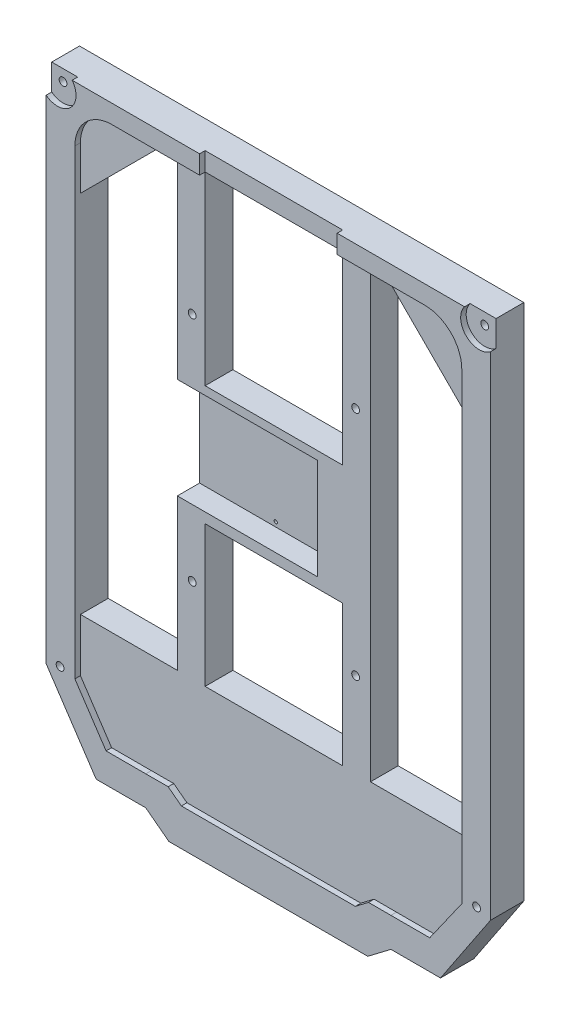
from build123d import *

# Parameters (mm, degrees)
BOSS_EXTRU_1_DEPTH                                = 30
ENL_V_MAT_EXTRU_1_DEPTH                           = 15
BOSS_EXTRU_2_DEPTH                                = 10
BOSS_EXTRU_3_DEPTH                                = 10
BOSS_EXTRU_4_DEPTH                                = 10
BOSS_EXTRU_5_DEPTH                                = 10
DIAM_TRE_DU_PER_AGE_4_2_4_2_1_D                   = 4.2
DIAM_TRE_DU_PER_AGE_4_2_4_2_1_DEPTH               = 40
CHAMBRAGE_POUR_VIS_T_TE_HEXAGONALE_M3_D           = 4.2
CHAMBRAGE_POUR_VIS_T_TE_HEXAGONALE_M3_DEPTH       = 40
CHAMBRAGE_POUR_VIS_T_TE_HEXAGONALE_M3_CBORE_D     = 20
CHAMBRAGE_POUR_VIS_T_TE_HEXAGONALE_M3_CBORE_DEPTH = 15
CONG_1_R                                          = 10
CONG_2_R                                          = 20
ENL_V_MAT_EXTRU_2_DEPTH                           = 270.645454496
TROU_TARAUD_M5X0_81_D                             = 4.2
TROU_TARAUD_M5X0_81_ON_FACE_2_D                   = 4.2
BOSS_EXTRU_6_DEPTH                                = 15
ESQUISSE14_W                                      = 344.623968027
ESQUISSE14_H                                      = 364.856294917
ENL_V_MAT_EXTRU_3_DEPTH                           = 12
BOSS_EXTRU_7_DEPTH                                = 15
ESQUISSE16_W                                      = 47
ESQUISSE16_H                                      = 54.5
ENL_V_MAT_EXTRU_4_DEPTH                           = 12
ESQUISSE17_R                                      = 0.5
ENL_V_MAT_EXTRU_5_DEPTH                           = 12
TROU_TARAUD_M2_2X0_451_D                          = 1.75
ENL_V_MAT_EXTRU_6_DEPTH                           = 270.645454496
BOSS_EXTRU_8_DEPTH                                = 15
ESQUISSE21_W                                      = 34.017882368
ESQUISSE21_H                                      = 54.5
ENL_V_MAT_EXTRU_7_DEPTH                           = 12
TROU_TARAUD_M5X0_82_D                             = 4.2
TROU_TARAUD_M5X0_82_DEPTH                         = 54.927
TROU_TARAUD_M5X0_82_TIP                           = 1.2618073
TROU_TARAUD_M5X0_84_D                             = 4.2
TROU_TARAUD_M5X0_84_DEPTH                         = 54.927
TROU_TARAUD_M5X0_84_TIP                           = 1.2618073


with BuildPart() as part:
    # Esquisse1 → Boss.-Extru.1 (new body)
    with BuildSketch(Plane.XY.offset(30)):
        Polygon((33.943844834, -122.117785393), (33.943844834, 157.882214607), (-206.056155166, 157.882214607), (-206.056155166, -122.117785393), (-179.056155166, -162.614832092), (-152.268878217, -162.614832092), (-139.750990012, -172.117785393), (-32.361320321, -172.117785393), (-19.843432116, -162.614832092), (6.943844834, -162.614832092), align=None)
    extrude(amount=-BOSS_EXTRU_1_DEPTH)

    # Esquisse2 → Enlèv. mat.-Extru.1 (cut)
    with BuildSketch(Plane.XY.offset(30)):
        Polygon((-123.206083599, 157.882214607), (-123.206083599, 147.882214607), (-190.556155166, 147.882214607), (-190.556155166, -121.431981452), (-173.70399548, -146.708377667), (-152.268878217, -146.708377667), (-140.175798707, -146.685066621), (-133.019479604, -152.117785393), (-39.092830728, -152.117785393), (-31.936511626, -146.685066621), (-19.843432116, -146.708377667), (1.141061448, -146.708377667), (18.443844834, -122.117785393), (18.443844834, 147.882214607), (-48.906226734, 147.882214607), (-48.906226734, 157.882214607), align=None)
    extrude(amount=-ENL_V_MAT_EXTRU_1_DEPTH, mode=Mode.SUBTRACT)

    # Esquisse3 → Boss.-Extru.2 (add)
    with BuildSketch(Plane(origin=(0, 0, 0), x_dir=(-1, 0, 0), z_dir=(0, 0, -1))):
        Polygon((162.596079372, 137.882214607), (162.596079372, 147.882214607), (190.556155166, 147.882214607), (190.556155166, 118.944465923), (180.556155166, 118.944465923), (180.556155166, 137.882214607), align=None)
    extrude(amount=BOSS_EXTRU_2_DEPTH)

    # Esquisse4 → Boss.-Extru.3 (add)
    with BuildSketch(Plane(origin=(0, 0, 0), x_dir=(-1, 0, 0), z_dir=(0, 0, -1))):
        Polygon((152.268878217, -136.708377667), (168.352374382, -136.708377667), (180.556155166, -118.404041358), (190.556155166, -121.431981452), (173.70399548, -146.708377667), (152.268878217, -146.708377667), align=None)
    extrude(amount=BOSS_EXTRU_3_DEPTH)

    # Esquisse5 → Boss.-Extru.4 (add)
    with BuildSketch(Plane(origin=(0, 0, 0), x_dir=(-1, 0, 0), z_dir=(0, 0, -1))):
        Polygon((-8.443844834, 137.882214607), (-8.443844834, 118.944465923), (-18.443844834, 118.944465923), (-18.443844834, 147.882214607), (9.516230961, 147.882214607), (9.516230961, 137.882214607), align=None)
    extrude(amount=BOSS_EXTRU_4_DEPTH)

    # Esquisse6 → Boss.-Extru.5 (add)
    with BuildSketch(Plane(origin=(0, 0, 0), x_dir=(-1, 0, 0), z_dir=(0, 0, -1))):
        Polygon((3.759935951, -136.708377667), (19.843432116, -136.708377667), (19.843432116, -146.708377667), (-1.141061448, -146.708377667), (-18.443844834, -122.117785393), (-8.443844834, -118.404041358), align=None)
    extrude(amount=BOSS_EXTRU_5_DEPTH)

    # Diamètre du perçage Ø4.2 (4.2)1
    with Locations(Plane.XY.offset(30)):
        with Locations((26.438895769, -119.607785393), (-198.551206101, -119.607785393)):
            Hole(DIAM_TRE_DU_PER_AGE_4_2_4_2_1_D / 2, depth=DIAM_TRE_DU_PER_AGE_4_2_4_2_1_DEPTH)

    # Chambrage pour vis à tête hexagonale M3.51
    with Locations(Plane.XY.offset(30)):
        with Locations((-199.94021721, 151.76627665), (27.827906877, 151.76627665)):
            CounterBoreHole(CHAMBRAGE_POUR_VIS_T_TE_HEXAGONALE_M3_D / 2, CHAMBRAGE_POUR_VIS_T_TE_HEXAGONALE_M3_CBORE_D / 2, CHAMBRAGE_POUR_VIS_T_TE_HEXAGONALE_M3_CBORE_DEPTH, depth=CHAMBRAGE_POUR_VIS_T_TE_HEXAGONALE_M3_DEPTH)

    # Congé1
    cong_1_edges = [part.edges().sort_by_distance(p)[0] for p in [
        (8.443844834, 137.882214607, -5),
        (-180.556155166, 137.882214607, -5),
    ]]
    fillet(cong_1_edges, radius=CONG_1_R)

    # Congé2
    cong_2_edges = [part.edges().sort_by_distance(p)[0] for p in [
        (18.443844834, 147.882214607, -5),
        (18.443844834, 147.882214607, 22.5),
        (-190.556155166, 147.882214607, 22.5),
        (-190.556155166, 147.882214607, -5),
    ]]
    fillet(cong_2_edges, radius=CONG_2_R)

    # Esquisse11 → Enlèv. mat.-Extru.2 (cut, through all)
    with BuildSketch(Plane.XY.offset(15)):
        Polygon((-123.206083599, 147.882214607), (-123.206083599, 47.882214607), (-190.556155166, -22.43592162), (-190.556155166, -92.767969228), (18.443844834, -92.767969228), (18.443844834, -22.43592162), (-48.906226734, 47.882214607), (-48.906226734, 147.882214607), align=None)
        Polygon((-138.206083599, 147.882214607), (-138.206083599, 57.882214607), (-190.556155166, 3.225116578), (-190.556155166, 95.532143039), (-190.556155166, 104.207178823), (-146.881119383, 147.882214607), align=None)
        Polygon((-33.906226734, 57.882214607), (18.443844834, 3.225116578), (18.443844834, 95.532143039), (18.443844834, 104.207178823), (-25.23119095, 147.882214607), (-33.906226734, 147.882214607), align=None)
    extrude(amount=-ENL_V_MAT_EXTRU_2_DEPTH, mode=Mode.SUBTRACT)

    # Trou taraudé M5x0.81 (through all)
    with Locations(Plane(origin=(-199.94021721, 151.76627665, 15), x_dir=(1, 0, 0), z_dir=(0, 0, 1))):
        with Locations((0, 0), (227.768124087, 0)):
            Hole(TROU_TARAUD_M5X0_81_D / 2)

    # Trou taraudé M5x0.81 on face 2 (through all)
    with Locations(Plane(origin=(26.438895769, -119.607785393, 30), x_dir=(1, 0, 0), z_dir=(0, 0, 1))):
        with Locations((0, 0), (-224.99010187, 0)):
            Hole(TROU_TARAUD_M5X0_81_ON_FACE_2_D / 2)

    # Esquisse13 → Boss.-Extru.6 (add)
    with BuildSketch(Plane.XY.offset(15)):
        Polygon((-48.906226734, 47.882214607), (-123.206083599, 47.882214607), (-148.90605105, 21.049669812), (-190.556155166, -22.43592162), (-190.556155166, -49.268466414), (-123.206083599, 21.049669812), (-48.906226734, 21.049669812), (18.443844834, -49.268466414), (18.443844834, -22.43592162), (-23.206259282, 21.049669812), align=None)
    extrude(amount=-BOSS_EXTRU_6_DEPTH)

    # Esquisse14 → Enlèv. mat.-Extru.3 (cut)
    with BuildSketch(Plane.XY.offset(30)):
        with Locations((-76.951608065, -8.129401738)):
            Rectangle(ESQUISSE14_W, ESQUISSE14_H)
    extrude(amount=-ENL_V_MAT_EXTRU_3_DEPTH, mode=Mode.SUBTRACT)

    # Esquisse15 → Boss.-Extru.7 (add)
    with BuildSketch(Plane.XY.offset(15)):
        Polygon((-165.240705537, 11.949496673), (-165.240705537, -16.671939758), (-10.373483375, -16.671939758), (-10.373483375, 17.080639576), (-29.498652377, 36.205808578), (-140.984393632, 36.205808578), align=None)
    extrude(amount=-BOSS_EXTRU_7_DEPTH)

    # Esquisse16 → Enlèv. mat.-Extru.4 (cut)
    with BuildSketch(Plane.XY.offset(15)):
        with Locations((-86.056155166, 16.099315521)):
            Rectangle(ESQUISSE16_W, ESQUISSE16_H)
    extrude(amount=-ENL_V_MAT_EXTRU_4_DEPTH, mode=Mode.SUBTRACT)

    # Esquisse17 → Enlèv. mat.-Extru.5 (cut)
    with BuildSketch(Plane.XY.offset(3)):
        with Locations((-97.061155166, 40.869315521)):
            Circle(ESQUISSE17_R)
        with Locations((-65.141155166, 16.099315521)):
            Circle(ESQUISSE17_R)
        with Locations((-97.061155166, -8.670684479)):
            Circle(ESQUISSE17_R)
    extrude(amount=-ENL_V_MAT_EXTRU_5_DEPTH, mode=Mode.SUBTRACT)

    # Trou taraudé M2.2x0.451 (through all)
    with Locations(Plane(origin=(-97.061155166, 40.869315521, 3), x_dir=(1, 0, 0), z_dir=(0, 0, 1))):
        with Locations((0, 0), (31.92, -24.77), (0, -49.54)):
            Hole(TROU_TARAUD_M2_2X0_451_D / 2)

    # Esquisse19 → Enlèv. mat.-Extru.6 (cut, through all)
    with BuildSketch(Plane.XY.offset(15)):
        Polygon((-138.206083599, -92.767969228), (-138.206083599, -16.671939758), (-159.335498292, -16.671939758), (-190.556155166, -49.268466414), (-190.556155166, -92.767969228), align=None)
        Polygon((-190.556155166, 3.225116578), (-138.206083599, 57.882214607), (-190.556155166, 57.882214607), align=None)
        Polygon((-138.206083599, -16.671939758), (-138.206083599, 57.882214607), (-190.556155166, 3.225116578), (-190.556155166, -49.268466414), (-159.335498292, -16.671939758), align=None)
        Polygon((18.443844834, 57.882214607), (-33.906226734, 57.882214607), (18.443844834, 3.225116578), align=None)
        Polygon((-33.906226734, 57.882214607), (-33.906226734, -16.671939758), (-12.77681204, -16.671939758), (18.443844834, -49.268466414), (18.443844834, 3.225116578), align=None)
        Polygon((-12.77681204, -16.671939758), (-33.906226734, -16.671939758), (-33.906226734, -92.767969228), (18.443844834, -92.767969228), (18.443844834, -49.268466414), align=None)
    extrude(amount=-ENL_V_MAT_EXTRU_6_DEPTH, mode=Mode.SUBTRACT)

    # Esquisse20 → Boss.-Extru.8 (add)
    with BuildSketch(Plane.XY.offset(15)):
        Polygon((-138.206083599, -16.671939758), (-138.206083599, -97.039238238), (-123.206083599, -97.039238238), (-123.206083599, 49.892057072), (-138.206083599, 49.892057072), align=None)
        Polygon((-48.906226734, 49.892057072), (-33.906226734, 49.892057072), (-33.906226734, -16.671939758), (-33.906226734, -97.039238238), (-48.906226734, -97.039238238), align=None)
    extrude(amount=-BOSS_EXTRU_8_DEPTH)

    # Esquisse21 → Enlèv. mat.-Extru.7 (cut)
    with BuildSketch(Plane.XY.offset(15)):
        with Locations((-126.56509635, 16.099315521)):
            Rectangle(ESQUISSE21_W, ESQUISSE21_H)
    extrude(amount=-ENL_V_MAT_EXTRU_7_DEPTH, mode=Mode.SUBTRACT)

    # Trou taraudé M5x0.82
    with Locations(Plane(origin=(-130.206083599, 77.882214607, 15), x_dir=(1, 0, 0), z_dir=(0, 0, 1))):
        with Locations((0, 0), (88.299856865, 0)):
            Hole(TROU_TARAUD_M5X0_82_D / 2, depth=TROU_TARAUD_M5X0_82_DEPTH)
            with Locations((0, 0, -(TROU_TARAUD_M5X0_82_DEPTH + TROU_TARAUD_M5X0_82_TIP / 2))):  # 118° drill point
                Cone(0, TROU_TARAUD_M5X0_82_D / 2, TROU_TARAUD_M5X0_82_TIP, mode=Mode.SUBTRACT)

    # Trou taraudé M5x0.84
    with Locations(Plane(origin=(-130.206083599, -47.117785393, 15), x_dir=(1, 0, 0), z_dir=(0, 0, 1))):
        with Locations((0, 0), (88.299856865, 0)):
            Hole(TROU_TARAUD_M5X0_84_D / 2, depth=TROU_TARAUD_M5X0_84_DEPTH)
            with Locations((0, 0, -(TROU_TARAUD_M5X0_84_DEPTH + TROU_TARAUD_M5X0_84_TIP / 2))):  # 118° drill point
                Cone(0, TROU_TARAUD_M5X0_84_D / 2, TROU_TARAUD_M5X0_84_TIP, mode=Mode.SUBTRACT)


solid = part.part
